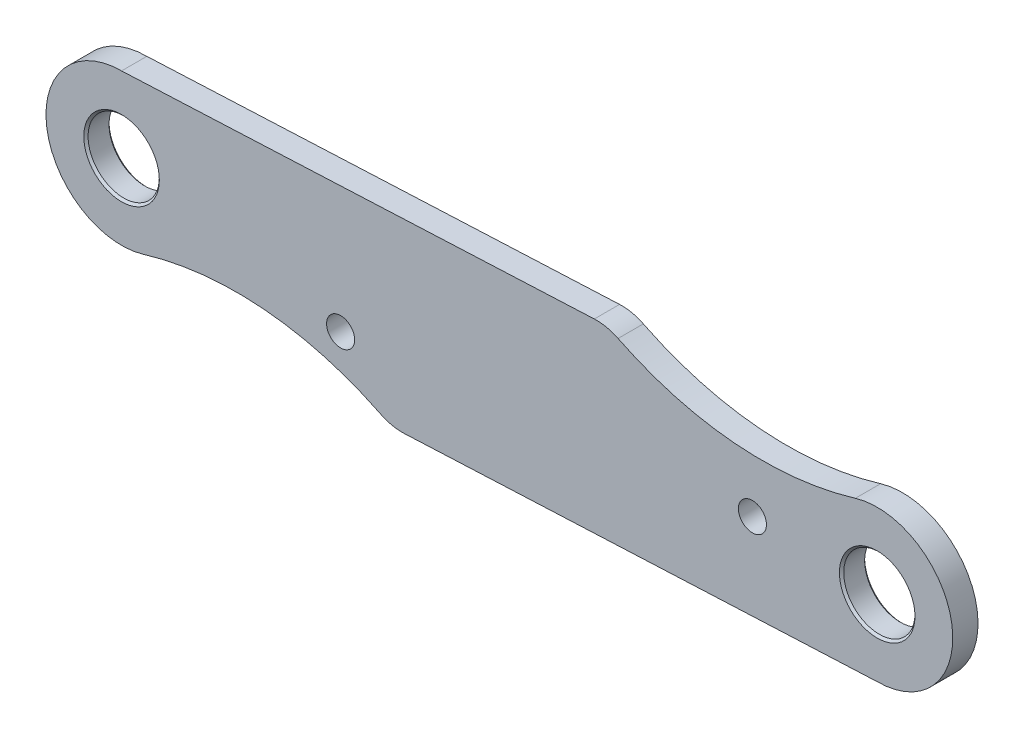
from build123d import *

# Parameters (mm, degrees)
CROQUIS1_R              = 16.5
SALIENTE_EXTRUIR1_DEPTH = 11.7
SALIENTE_EXTRUIR6_START = -11.7
CROQUIS9_R              = 16.5
SALIENTE_EXTRUIR6_DEPTH = 11.7
SALIENTE_EXTRUIR5_START = -11.7
CROQUIS8_R              = 35
CROQUIS8_R_2            = 16.5
CROQUIS8_R_3            = 22.5
SALIENTE_EXTRUIR5_DEPTH = 11.7
CHAFL_N1_SIZE           = 1
CORTAR_EXTRUIR7_REACH   = 217.086
CROQUIS19_R             = 6.5


with BuildPart() as part:
    # Croquis1 → Saliente-Extruir1 (new body)
    with BuildSketch(Plane.XY):
        with BuildLine():
            Line((-197.5, 25), (197.5, 25))
            ThreePointArc((197.5, 25), (203.120875688, 0), (197.5, -25))
            Line((197.5, -25), (-197.5, -25))
            ThreePointArc((-197.5, -25), (-203.120875688, 0), (-197.5, 25))
        make_face()
        with Locations((-175, 0)):
            Circle(CROQUIS1_R, mode=Mode.SUBTRACT)
        with Locations((175, 0)):
            Circle(CROQUIS1_R, mode=Mode.SUBTRACT)
    extrude(amount=SALIENTE_EXTRUIR1_DEPTH)

    # Croquis9 → Saliente-Extruir6 (add)
    # profile 1 of 17: a face of its own
    with BuildSketch(Plane.XY.offset(11.7).offset(SALIENTE_EXTRUIR6_START)):
        with BuildLine():
            ThreePointArc((-140, 0), (-142.732978058, 13.558735008), (-150.505102572, 25))
            Line((-150.505102572, 25), (-197.5, 25))
            ThreePointArc((-197.5, 25), (-203.120875688, 0), (-197.5, -25))
            Line((-197.5, -25), (-150.505102572, -25))
            ThreePointArc((-150.505102572, -25), (-142.732978058, -13.558735008), (-140, 0))
        make_face()
        with Locations((-175, 0)):
            Circle(CROQUIS9_R, mode=Mode.SUBTRACT)
    # profile 2 of 17: a face of its own
    with BuildSketch(Plane.XY.offset(11.7).offset(SALIENTE_EXTRUIR6_START)):
        with BuildLine():
            ThreePointArc((-150.505102572, 25), (-161.771243445, 32.403703492), (-175, 35))
            ThreePointArc((-175, 35), (-209.624362587, -5.114050788), (-164.881671498, -33.505513402))
            ThreePointArc((-164.881671498, -33.505513402), (-157.178530031, -30.123001313), (-150.505102572, -25))
            Line((-150.505102572, -25), (-197.5, -25))
            ThreePointArc((-197.5, -25), (-203.120875688, 0), (-197.5, 25))
            Line((-197.5, 25), (-150.505102572, 25))
        make_face()
    # profile 3 of 17: a face of its own
    with BuildSketch(Plane.XY.offset(11.7).offset(SALIENTE_EXTRUIR6_START)):
        with BuildLine():
            Line((43.975947947, 44.976683861), (-175, 35))
            ThreePointArc((-175, 35), (-161.771243445, 32.403703492), (-150.505102572, 25))
            Line((-150.505102572, 25), (22.639320225, 25))
            ThreePointArc((22.639320225, 25), (29.62214595, 38.92472541), (43.975947947, 44.976683861))
        make_face()
    # profile 4 of 17: a face of its own
    with BuildSketch(Plane.XY.offset(11.7).offset(SALIENTE_EXTRUIR6_START)):
        with BuildLine():
            Line((22.639320225, 25), (-150.505102572, 25))
            ThreePointArc((-150.505102572, 25), (-142.732978058, 13.558735008), (-140, 0))
            ThreePointArc((-140, 0), (-142.732978058, -13.558735008), (-150.505102572, -25))
            Line((-150.505102572, -25), (-67.360679775, -25))
            ThreePointArc((-67.360679775, -25), (-46.251939508, -0.034857057), (-22.5, -22.5))
            ThreePointArc((-22.5, -22.5), (-22.534857057, -23.751939508), (-22.639320225, -25))
            Line((-22.639320225, -25), (150.505102572, -25))
            ThreePointArc((150.505102572, -25), (140, 0), (150.505102572, 25))
            Line((150.505102572, 25), (67.360679775, 25))
            ThreePointArc((67.360679775, 25), (67.465142943, 23.751939508), (67.5, 22.5))
            ThreePointArc((67.5, 22.5), (43.748060492, 0.034857057), (22.639320225, 25))
        make_face()
    # profile 5 of 17: a face of its own
    with BuildSketch(Plane.XY.offset(11.7).offset(SALIENTE_EXTRUIR6_START)):
        with BuildLine():
            ThreePointArc((-150.505102572, -25), (-157.178530031, -30.123001313), (-164.881671498, -33.505513402))
            ThreePointArc((-164.881671498, -33.505513402), (-109.058760851, -27.618859086), (-54.980531281, -42.665291849))
            ThreePointArc((-54.980531281, -42.665291849), (-63.425637497, -35.413012152), (-67.360679775, -25))
            Line((-67.360679775, -25), (-150.505102572, -25))
        make_face()
    # profile 6 of 17: a face of its own
    with BuildSketch(Plane.XY.offset(11.7).offset(SALIENTE_EXTRUIR6_START)):
        with BuildLine():
            ThreePointArc((-67.360679775, -25), (-63.425637497, -35.413012152), (-54.980531281, -42.665291849))
            ThreePointArc((-54.980531281, -42.665291849), (-49.624960897, -44.519530801), (-43.975947947, -44.976683861))
            ThreePointArc((-43.975947947, -44.976683861), (-29.62214595, -38.92472541), (-22.639320225, -25))
            Line((-22.639320225, -25), (-67.360679775, -25))
        make_face()
    # profile 7 of 17: a face of its own
    with BuildSketch(Plane.XY.offset(11.7).offset(SALIENTE_EXTRUIR6_START)):
        with BuildLine():
            ThreePointArc((-22.5, -22.5), (-46.251939508, -0.034857057), (-67.360679775, -25))
            Line((-67.360679775, -25), (-22.639320225, -25))
            ThreePointArc((-22.639320225, -25), (-22.534857057, -23.751939508), (-22.5, -22.5))
        make_face()
    # profile 8 of 17: a face of its own
    with BuildSketch(Plane.XY.offset(11.7).offset(SALIENTE_EXTRUIR6_START)):
        with BuildLine():
            ThreePointArc((-67.360679775, -25), (-63.425637497, -35.413012152), (-54.980531281, -42.665291849))
            ThreePointArc((-54.980531281, -42.665291849), (-49.624960897, -44.519530801), (-43.975947947, -44.976683861))
            ThreePointArc((-43.975947947, -44.976683861), (-29.62214595, -38.92472541), (-22.639320225, -25))
            Line((-22.639320225, -25), (-67.360679775, -25))
        make_face()
    # profile 9 of 17: a face of its own
    with BuildSketch(Plane.XY.offset(11.7).offset(SALIENTE_EXTRUIR6_START)):
        with BuildLine():
            ThreePointArc((-22.5, -22.5), (-46.251939508, -0.034857057), (-67.360679775, -25))
            Line((-67.360679775, -25), (-22.639320225, -25))
            ThreePointArc((-22.639320225, -25), (-22.534857057, -23.751939508), (-22.5, -22.5))
        make_face()
    # profile 10 of 17: a face of its own
    with BuildSketch(Plane.XY.offset(11.7).offset(SALIENTE_EXTRUIR6_START)):
        with BuildLine():
            ThreePointArc((54.980531281, 42.665291849), (49.624960897, 44.519530801), (43.975947947, 44.976683861))
            ThreePointArc((43.975947947, 44.976683861), (29.62214595, 38.92472541), (22.639320225, 25))
            Line((22.639320225, 25), (67.360679775, 25))
            ThreePointArc((67.360679775, 25), (63.425637497, 35.413012152), (54.980531281, 42.665291849))
        make_face()
    # profile 11 of 17: a face of its own
    with BuildSketch(Plane.XY.offset(11.7).offset(SALIENTE_EXTRUIR6_START)):
        with BuildLine():
            Line((67.360679775, 25), (22.639320225, 25))
            ThreePointArc((22.639320225, 25), (43.748060492, 0.034857057), (67.5, 22.5))
            ThreePointArc((67.5, 22.5), (67.465142943, 23.751939508), (67.360679775, 25))
        make_face()
    # profile 12 of 17: a face of its own
    with BuildSketch(Plane.XY.offset(11.7).offset(SALIENTE_EXTRUIR6_START)):
        with BuildLine():
            ThreePointArc((54.980531281, 42.665291849), (49.624960897, 44.519530801), (43.975947947, 44.976683861))
            ThreePointArc((43.975947947, 44.976683861), (29.62214595, 38.92472541), (22.639320225, 25))
            Line((22.639320225, 25), (67.360679775, 25))
            ThreePointArc((67.360679775, 25), (63.425637497, 35.413012152), (54.980531281, 42.665291849))
        make_face()
    # profile 13 of 17: a face of its own
    with BuildSketch(Plane.XY.offset(11.7).offset(SALIENTE_EXTRUIR6_START)):
        with BuildLine():
            Line((67.360679775, 25), (22.639320225, 25))
            ThreePointArc((22.639320225, 25), (43.748060492, 0.034857057), (67.5, 22.5))
            ThreePointArc((67.5, 22.5), (67.465142943, 23.751939508), (67.360679775, 25))
        make_face()
    # profile 14 of 17: a face of its own
    with BuildSketch(Plane.XY.offset(11.7).offset(SALIENTE_EXTRUIR6_START)):
        with BuildLine():
            ThreePointArc((164.881671498, 33.505513402), (109.058760851, 27.618859086), (54.980531281, 42.665291849))
            ThreePointArc((54.980531281, 42.665291849), (63.425637497, 35.413012152), (67.360679775, 25))
            Line((67.360679775, 25), (150.505102572, 25))
            ThreePointArc((150.505102572, 25), (157.178530031, 30.123001313), (164.881671498, 33.505513402))
        make_face()
    # profile 15 of 17: a face of its own
    with BuildSketch(Plane.XY.offset(11.7).offset(SALIENTE_EXTRUIR6_START)):
        with BuildLine():
            ThreePointArc((-22.639320225, -25), (-29.62214595, -38.92472541), (-43.975947947, -44.976683861))
            Line((-43.975947947, -44.976683861), (175, -35))
            ThreePointArc((175, -35), (161.771243445, -32.403703492), (150.505102572, -25))
            Line((150.505102572, -25), (-22.639320225, -25))
        make_face()
    # profile 16 of 17: a face of its own
    with BuildSketch(Plane.XY.offset(11.7).offset(SALIENTE_EXTRUIR6_START)):
        with BuildLine():
            ThreePointArc((210, 0), (195.866941588, 28.099301571), (164.881671498, 33.505513402))
            ThreePointArc((164.881671498, 33.505513402), (157.178530031, 30.123001313), (150.505102572, 25))
            Line((150.505102572, 25), (197.5, 25))
            ThreePointArc((197.5, 25), (203.120875688, 0), (197.5, -25))
            Line((197.5, -25), (150.505102572, -25))
            ThreePointArc((150.505102572, -25), (161.771243445, -32.403703492), (175, -35))
            ThreePointArc((175, -35), (199.748737342, -24.748737342), (210, 0))
        make_face()
    # profile 17 of 17: a face of its own
    with BuildSketch(Plane.XY.offset(11.7).offset(SALIENTE_EXTRUIR6_START)):
        with BuildLine():
            Line((197.5, 25), (150.505102572, 25))
            ThreePointArc((150.505102572, 25), (140, 0), (150.505102572, -25))
            Line((150.505102572, -25), (197.5, -25))
            ThreePointArc((197.5, -25), (203.120875688, 0), (197.5, 25))
        make_face()
        with Locations((175, 0)):
            Circle(CROQUIS9_R, mode=Mode.SUBTRACT)
    extrude(amount=SALIENTE_EXTRUIR6_DEPTH)

    # Croquis8 → Saliente-Extruir5 (add)
    # profile 1 of 4: a face of its own
    with BuildSketch(Plane.XY.offset(11.7).offset(SALIENTE_EXTRUIR5_START)):
        with Locations((-175, 0)):
            Circle(CROQUIS8_R)
        with Locations((-175, 0)):
            Circle(CROQUIS8_R_2, mode=Mode.SUBTRACT)
    # profile 2 of 4: a face of its own
    with BuildSketch(Plane.XY.offset(11.7).offset(SALIENTE_EXTRUIR5_START)):
        with Locations((175, 0)):
            Circle(CROQUIS8_R)
        with Locations((175, 0)):
            Circle(CROQUIS8_R_2, mode=Mode.SUBTRACT)
    # profile 3 of 4: a face of its own
    with BuildSketch(Plane.XY.offset(11.7).offset(SALIENTE_EXTRUIR5_START)):
        with Locations((45, 22.5)):
            Circle(CROQUIS8_R_3)
    # profile 4 of 4: a face of its own
    with BuildSketch(Plane.XY.offset(11.7).offset(SALIENTE_EXTRUIR5_START)):
        with Locations((-45, -22.5)):
            Circle(CROQUIS8_R_3)
    extrude(amount=SALIENTE_EXTRUIR5_DEPTH)

    # Chaflán1
    chafl_n1_edges = [part.edges().sort_by_distance(p)[0] for p in [
        (-191.5, 0, 0),
        (-191.5, 0, 11.7),
        (158.5, 0, 0),
        (158.5, 0, 11.7),
    ]]
    chamfer(chafl_n1_edges, length=CHAFL_N1_SIZE)

    # Croquis19 → Cortar-Extruir7 (cut, up to next)
    with BuildSketch(Plane(origin=(0, 0, 0), x_dir=(-1, 0, 0), z_dir=(0, 0, -1)), mode=Mode.PRIVATE) as cortar_extruir7_sk1:
        with Locations((73.534579942, -18.901548417)):
            Circle(CROQUIS19_R)
    cortar_extruir7_tool1 = extrude(cortar_extruir7_sk1.sketch, amount=-CORTAR_EXTRUIR7_REACH, mode=Mode.PRIVATE) & part.part
    # Croquis19 → Cortar-Extruir7 (cut, up to next)
    with BuildSketch(Plane(origin=(0, 0, 0), x_dir=(-1, 0, 0), z_dir=(0, 0, -1)), mode=Mode.PRIVATE) as cortar_extruir7_sk2:
        with Locations((-117.200528877, 2.301431648)):
            Circle(CROQUIS19_R)
    cortar_extruir7_tool2 = extrude(cortar_extruir7_sk2.sketch, amount=-CORTAR_EXTRUIR7_REACH, mode=Mode.PRIVATE) & part.part
    add(cortar_extruir7_tool1.solids().sort_by_distance((-73.53458, -18.901548, 0))[0], mode=Mode.SUBTRACT)
    add(cortar_extruir7_tool2.solids().sort_by_distance((117.200529, 2.301432, 0))[0], mode=Mode.SUBTRACT)


solid = part.part
